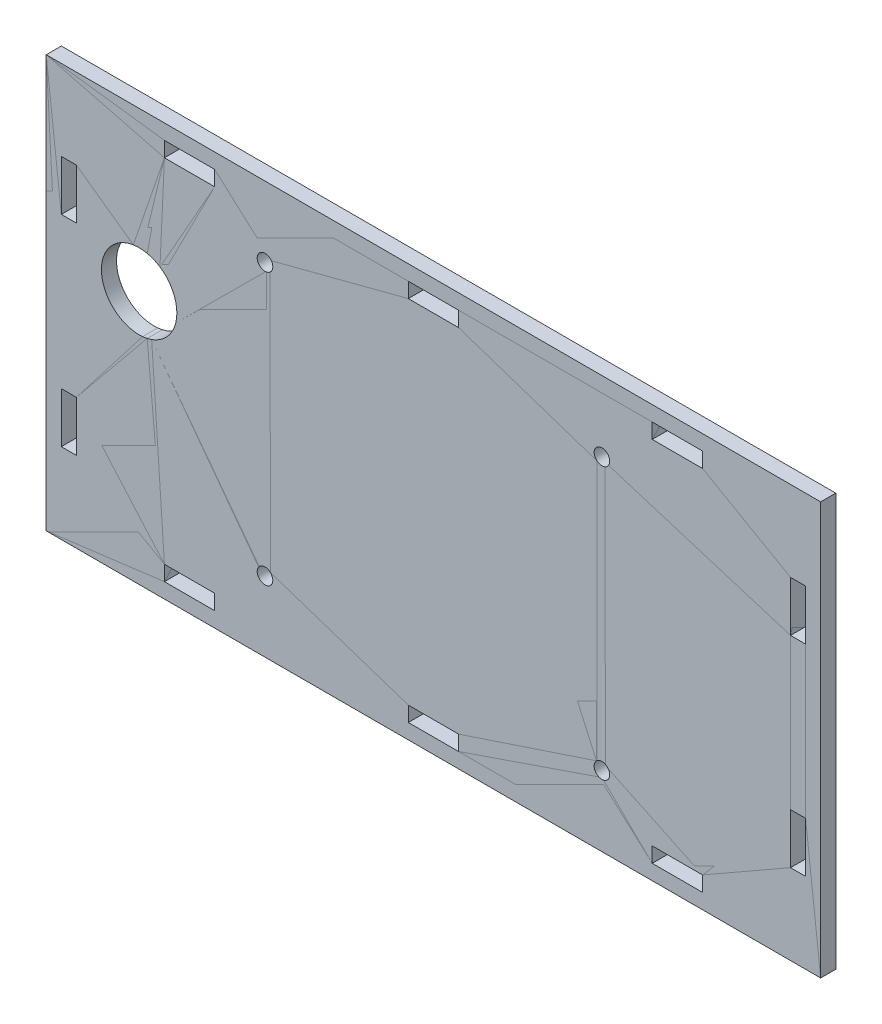
from build123d import *

# Parameters (mm, degrees)
SKETCH_1_2_W    = 154
SKETCH_1_2_H    = 82
SKETCH_1_2_R    = 1.55
SKETCH_1_2_R_2  = 7.5
SKETCH_1_2_W_2  = 3
SKETCH_1_2_H_2  = 10
SKETCH_1_2_W_3  = 10
SKETCH_1_2_H_3  = 3
EXTRUDE_2_DEPTH = 3
SKETCH_1_W      = 154
SKETCH_1_H      = 82
SKETCH_1_R      = 1.55
SKETCH_1_R_2    = 7.5
SKETCH_1_W_2    = 3
SKETCH_1_H_2    = 10
SKETCH_1_W_3    = 10
SKETCH_1_H_3    = 3
EXTRUDE_1_DEPTH = 3


with BuildPart() as part:
    # 草图1<2> → 凸台-拉伸2 (new body)
    with BuildSketch(Plane.XY):
        with Locations((0, -9.501246883)):
            Rectangle(SKETCH_1_2_W, SKETCH_1_2_H)
        with Locations((-33.5, 17.5)):
            Circle(SKETCH_1_2_R, mode=Mode.SUBTRACT)
        with Locations((-33.5, -36.502493766)):
            Circle(SKETCH_1_2_R, mode=Mode.SUBTRACT)
        with Locations((33.5, -36.502493766)):
            Circle(SKETCH_1_2_R, mode=Mode.SUBTRACT)
        with Locations((33.5, 17.5)):
            Circle(SKETCH_1_2_R, mode=Mode.SUBTRACT)
        with Locations((-58.526601202, 0)):
            Circle(SKETCH_1_2_R_2, mode=Mode.SUBTRACT)
        with Locations((-72.5, -29.501246883)):
            Rectangle(SKETCH_1_2_W_2, SKETCH_1_2_H_2, mode=Mode.SUBTRACT)
        with Locations((-48.5, -46.001246883)):
            Rectangle(SKETCH_1_2_W_3, SKETCH_1_2_H_3, mode=Mode.SUBTRACT)
        with Locations((0, -46.001246883)):
            Rectangle(SKETCH_1_2_W_3, SKETCH_1_2_H_3, mode=Mode.SUBTRACT)
        with Locations((0, 26.998753117)):
            Rectangle(SKETCH_1_2_W_3, SKETCH_1_2_H_3, mode=Mode.SUBTRACT)
        with Locations((-48.5, 26.998753117)):
            Rectangle(SKETCH_1_2_W_3, SKETCH_1_2_H_3, mode=Mode.SUBTRACT)
        with Locations((-72.5, 10.498753117)):
            Rectangle(SKETCH_1_2_W_2, SKETCH_1_2_H_2, mode=Mode.SUBTRACT)
        with Locations((48.5, -46.001246883)):
            Rectangle(SKETCH_1_2_W_3, SKETCH_1_2_H_3, mode=Mode.SUBTRACT)
        with Locations((72.5, -29.501246883)):
            Rectangle(SKETCH_1_2_W_2, SKETCH_1_2_H_2, mode=Mode.SUBTRACT)
        with Locations((72.5, 10.498753117)):
            Rectangle(SKETCH_1_2_W_2, SKETCH_1_2_H_2, mode=Mode.SUBTRACT)
        with Locations((48.5, 26.998753117)):
            Rectangle(SKETCH_1_2_W_3, SKETCH_1_2_H_3, mode=Mode.SUBTRACT)
    extrude(amount=EXTRUDE_2_DEPTH)


with BuildPart() as body_2:
    # 草图1 → 凸台-拉伸1 (new body)
    with BuildSketch(Plane.XY):
        with Locations((0, -9.501246883)):
            Rectangle(SKETCH_1_W, SKETCH_1_H)
        with Locations((-33.5, 17.5)):
            Circle(SKETCH_1_R, mode=Mode.SUBTRACT)
        with Locations((-33.5, -36.502493766)):
            Circle(SKETCH_1_R, mode=Mode.SUBTRACT)
        with Locations((33.5, -36.502493766)):
            Circle(SKETCH_1_R, mode=Mode.SUBTRACT)
        with Locations((33.5, 17.5)):
            Circle(SKETCH_1_R, mode=Mode.SUBTRACT)
        with Locations((-58.526601202, 0)):
            Circle(SKETCH_1_R_2, mode=Mode.SUBTRACT)
        with Locations((-72.5, -29.501246883)):
            Rectangle(SKETCH_1_W_2, SKETCH_1_H_2, mode=Mode.SUBTRACT)
        with Locations((-48.5, -46.001246883)):
            Rectangle(SKETCH_1_W_3, SKETCH_1_H_3, mode=Mode.SUBTRACT)
        with Locations((0, -46.001246883)):
            Rectangle(SKETCH_1_W_3, SKETCH_1_H_3, mode=Mode.SUBTRACT)
        with Locations((0, 26.998753117)):
            Rectangle(SKETCH_1_W_3, SKETCH_1_H_3, mode=Mode.SUBTRACT)
        with Locations((-48.5, 26.998753117)):
            Rectangle(SKETCH_1_W_3, SKETCH_1_H_3, mode=Mode.SUBTRACT)
        with Locations((-72.5, 10.498753117)):
            Rectangle(SKETCH_1_W_2, SKETCH_1_H_2, mode=Mode.SUBTRACT)
        with Locations((48.5, -46.001246883)):
            Rectangle(SKETCH_1_W_3, SKETCH_1_H_3, mode=Mode.SUBTRACT)
        with Locations((72.5, -29.501246883)):
            Rectangle(SKETCH_1_W_2, SKETCH_1_H_2, mode=Mode.SUBTRACT)
        with Locations((72.5, 10.498753117)):
            Rectangle(SKETCH_1_W_2, SKETCH_1_H_2, mode=Mode.SUBTRACT)
        with Locations((48.5, 26.998753117)):
            Rectangle(SKETCH_1_W_3, SKETCH_1_H_3, mode=Mode.SUBTRACT)
    extrude(amount=EXTRUDE_1_DEPTH)


solid = Compound([part.part, body_2.part])
